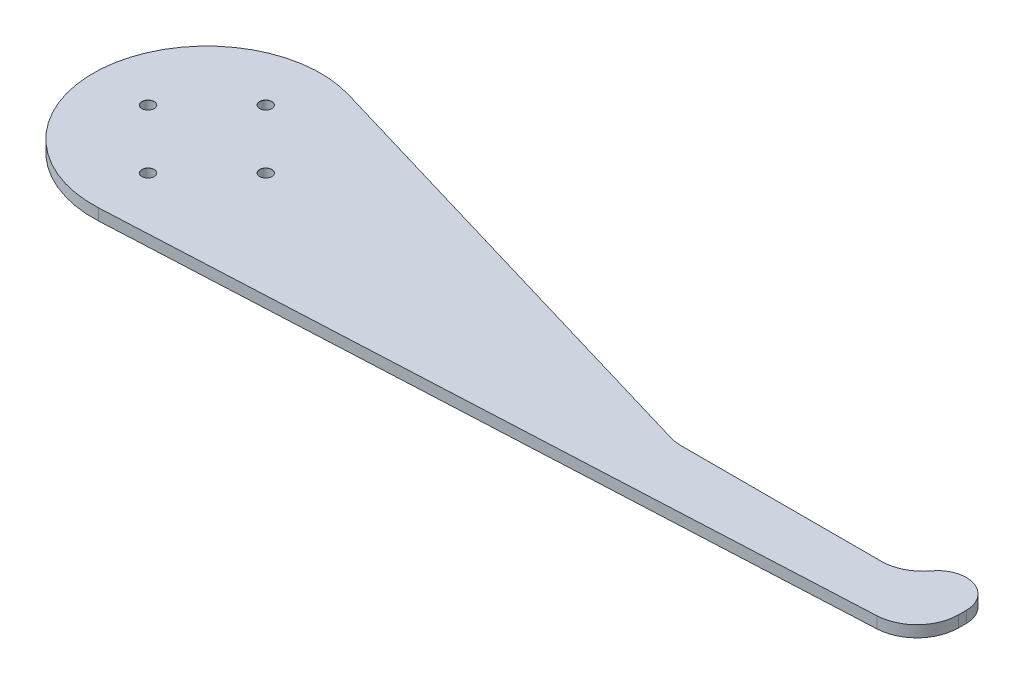
from build123d import *

# Parameters (mm, degrees)
BOSS_EXTRUDE1_DEPTH            = 3
M3_CLEARANCE_HOLE1_D           = 3.2
M3_CLEARANCE_HOLE1_CSINK_D     = 3.25
M3_CLEARANCE_HOLE1_CSINK_ANGLE = 90
FILLET2_R                      = 11


with BuildPart() as part:
    # Sketch1 → Boss-Extrude1 (new body)
    with BuildSketch(Plane(origin=(0, 0, 0), x_dir=(1, 0, 0), z_dir=(0, 1, 0))):
        with BuildLine():
            ThreePointArc((8.529623766, 28.761876128), (-29.78438528, 3.590319411), (1.450480292, -29.964914599))
            Line((1.450480292, -29.964914599), (207.5, -19.990892525))
            Line((207.5, -19.990892525), (207.5, -7.5))
            ThreePointArc((207.5, -7.5), (200, 0), (192.5, -7.5))
            Line((192.5, -7.5), (130.80460541, -7.5))
            Line((130.80460541, -7.5), (8.529623766, 28.761876128))
        make_face()
    extrude(amount=BOSS_EXTRUDE1_DEPTH)

    # M3 Clearance Hole1 (through all)
    with Locations(Plane(origin=(0, 3, 0), x_dir=(1, 0, 0), z_dir=(0, 1, 0))):
        with Locations((-15.5, 0), (0, 15.5), (15.5, 0), (0, -15.5)):
            CounterSinkHole(M3_CLEARANCE_HOLE1_D / 2, M3_CLEARANCE_HOLE1_CSINK_D / 2, counter_sink_angle=M3_CLEARANCE_HOLE1_CSINK_ANGLE)

    # Fillet2
    fillet2_edges = [part.edges().sort_by_distance(p)[0] for p in [
        (130.80460541, 1.5, 7.5),
        (192.5, 1.5, 7.5),
        (207.5, 1.5, 19.990892525),
    ]]
    fillet(fillet2_edges, radius=FILLET2_R)


solid = part.part
